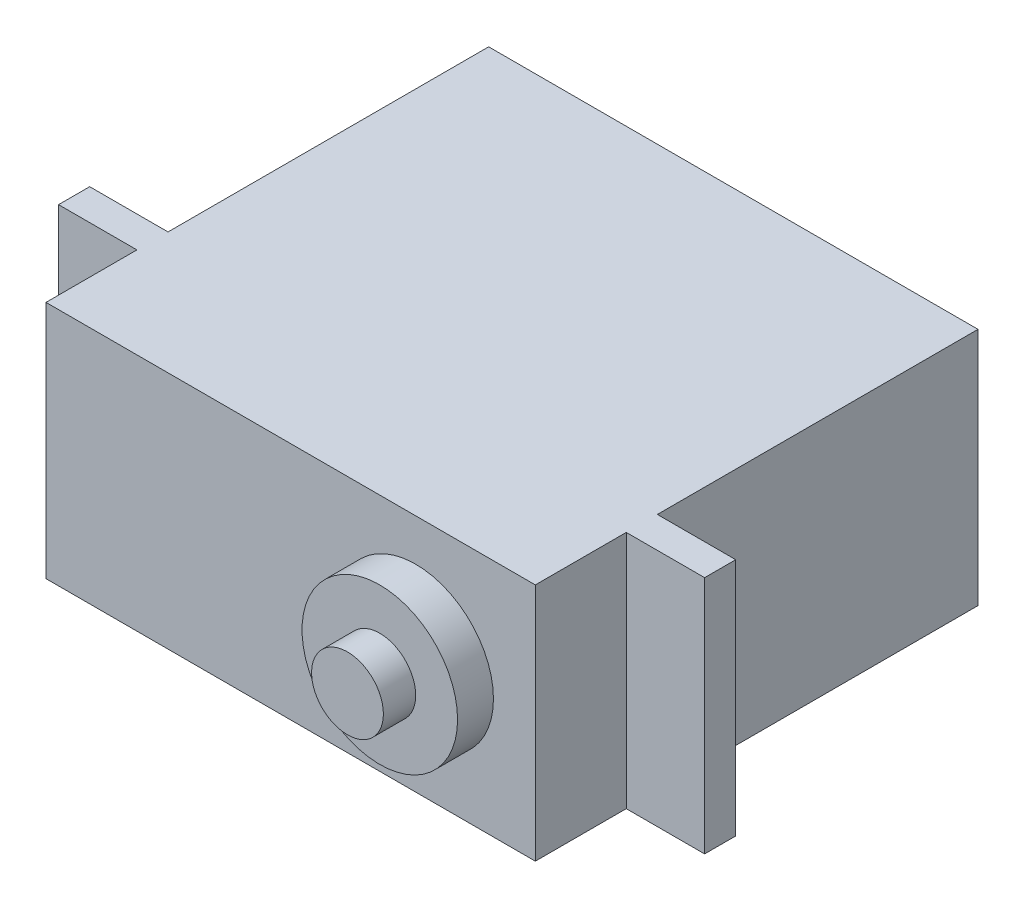
from build123d import *

# Parameters (mm, degrees)
CASE_40P9_X_20_X_37_START             = -28.5
CASE_40P9_X_20_X_37_PROFILE_W         = 40.9
CASE_40P9_X_20_X_37_PROFILE_H         = 20
CASE_40P9_X_20_X_37_DEPTH             = 37
MOUNTING_TABS_54_X_20_X_2P6_START     = -1.7
MOUNTING_TABS_54_X_20_X_2P6_PROFILE_W = 54
MOUNTING_TABS_54_X_20_X_2P6_PROFILE_H = 20
MOUNTING_TABS_54_X_20_X_2P6_DEPTH     = 2.6
OUTPUT_BOSS_D13_START                 = 8.5
OUTPUT_BOSS_D13_PROFILE_R             = 6.5
OUTPUT_BOSS_D13_DEPTH                 = 3
OUTPUT_SHAFT_ENVELOPE_D6_START        = 8.5
OUTPUT_SHAFT_ENVELOPE_D6_PROFILE_R    = 3
OUTPUT_SHAFT_ENVELOPE_D6_DEPTH        = 5.7


with BuildPart() as part:
    # Case_40p9_x_20_x_37_Profile → Case_40p9_x_20_x_37 (new body)
    with BuildSketch(Plane.XY.offset(CASE_40P9_X_20_X_37_START)):
        with Locations((2.05, 0)):
            Rectangle(CASE_40P9_X_20_X_37_PROFILE_W, CASE_40P9_X_20_X_37_PROFILE_H)
    extrude(amount=CASE_40P9_X_20_X_37_DEPTH)

    # Mounting_tabs_54_x_20_x_2p6_Profile → Mounting_tabs_54_x_20_x_2p6 (add)
    with BuildSketch(Plane.XY.offset(MOUNTING_TABS_54_X_20_X_2P6_START)):
        with Locations((2.05, 0)):
            Rectangle(MOUNTING_TABS_54_X_20_X_2P6_PROFILE_W, MOUNTING_TABS_54_X_20_X_2P6_PROFILE_H)
    extrude(amount=MOUNTING_TABS_54_X_20_X_2P6_DEPTH)

    # Output_boss_D13_Profile → Output_boss_D13 (add)
    with BuildSketch(Plane.XY.offset(OUTPUT_BOSS_D13_START)):
        with Locations((12.5, 0)):
            Circle(OUTPUT_BOSS_D13_PROFILE_R)
    extrude(amount=OUTPUT_BOSS_D13_DEPTH)

    # Output_shaft_envelope_D6_Profile → Output_shaft_envelope_D6 (add)
    with BuildSketch(Plane.XY.offset(OUTPUT_SHAFT_ENVELOPE_D6_START)):
        with Locations((12.5, 0)):
            Circle(OUTPUT_SHAFT_ENVELOPE_D6_PROFILE_R)
    extrude(amount=OUTPUT_SHAFT_ENVELOPE_D6_DEPTH)


solid = part.part
